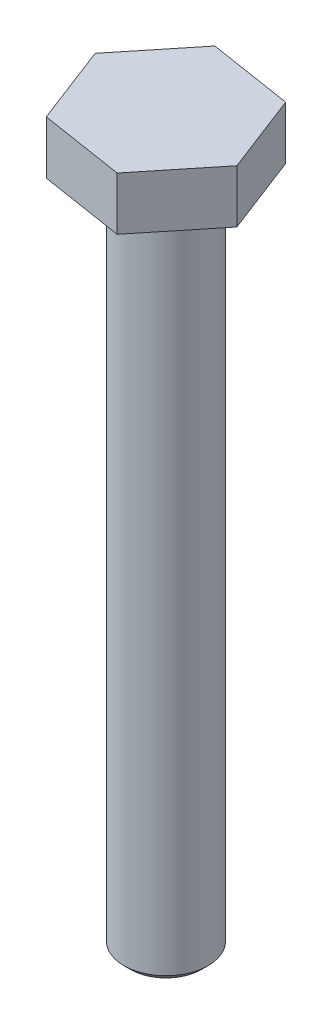
from build123d import *

# Parameters (mm, degrees)
SKETCH1_R           = 3.175
BOSS_EXTRUDE1_DEPTH = 50.8
BOSS_EXTRUDE2_DEPTH = 4
CHAMFER1_SIZE       = 0.5


with BuildPart() as part:
    # Sketch1 → Boss-Extrude1 (new body)
    with BuildSketch(Plane(origin=(0, 0, 0), x_dir=(1, 0, 0), z_dir=(0, 1, 0))):
        with Locations(Location((0, 0, 0), (0, 0, 270))):
            Circle(SKETCH1_R)
    extrude(amount=BOSS_EXTRUDE1_DEPTH)

    # Sketch2 → Boss-Extrude2 (add)
    with BuildSketch(Plane(origin=(0, 50.8, 0), x_dir=(1, 0, 0), z_dir=(0, 1, 0))):
        Polygon((-2.30492787, 5.987475227), (-6.337769586, 0.997611524), (-4.032841716, -4.989863703), (2.30492787, -5.987475227), (6.337769586, -0.997611524), (4.032841716, 4.989863703), align=None)
    extrude(amount=BOSS_EXTRUDE2_DEPTH)

    # Chamfer1
    chamfer1_edges = [part.edges().sort_by_distance(p)[0] for p in [
        (0, 0, -3.175),
    ]]
    chamfer(chamfer1_edges, length=CHAMFER1_SIZE)


solid = part.part
